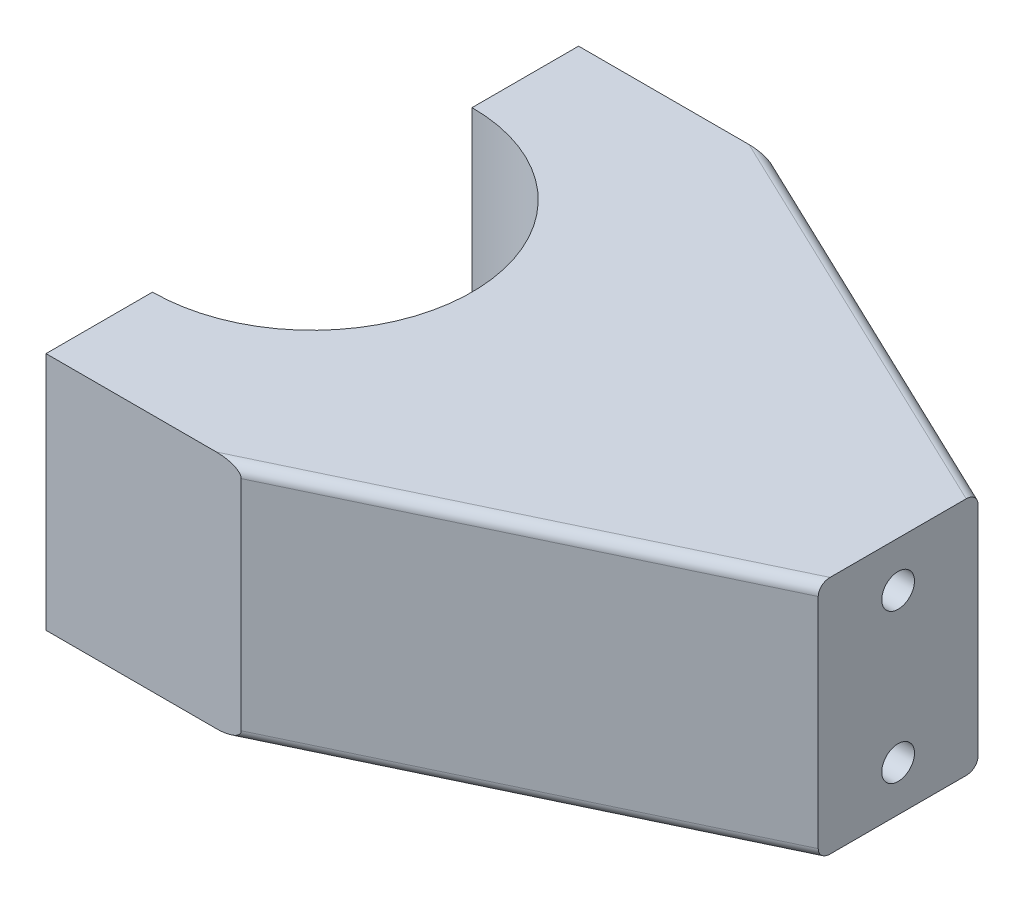
from build123d import *

# Parameters (mm, degrees)
SALIENTE_EXTRUIR1_DEPTH = 45
CROQUIS2_R              = 3.075
CORTAR_EXTRUIR1_DEPTH   = 129.937969582
REDONDEO1_R             = 2


with BuildPart() as part:
    # Croquis1 → Saliente-Extruir1 (new body)
    with BuildSketch(Plane(origin=(0, 0, 0), x_dir=(1, 0, 0), z_dir=(0, 1, 0))):
        with BuildLine():
            Line((0, 30), (0, 50))
            Line((0, 50), (36.66060556, 50))
            Line((36.66060556, 50), (110, 15))
            Line((110, 15), (110, -15))
            Line((110, -15), (36.66060556, -50))
            Line((36.66060556, -50), (0, -50))
            Line((0, -50), (0, -30))
            ThreePointArc((0, -30), (30, 0), (0, 30))
        make_face()
    extrude(amount=SALIENTE_EXTRUIR1_DEPTH)

    # Croquis2 → Cortar-Extruir1 (cut, through all)
    with BuildSketch(Plane(origin=(110, 0, 0), x_dir=(0, 0, -1), z_dir=(1, 0, 0))):
        with Locations((0, 36.5)):
            Circle(CROQUIS2_R)
        with Locations((0, 8.5)):
            Circle(CROQUIS2_R)
    extrude(amount=-CORTAR_EXTRUIR1_DEPTH, mode=Mode.SUBTRACT)

    # Redondeo1
    redondeo1_edges = [part.edges().sort_by_distance(p)[0] for p in [
        (73.33030278, 0, -32.5),
        (73.33030278, 45, -32.5),
        (73.33030278, 0, 32.5),
        (73.33030278, 45, 32.5),
    ]]
    fillet(redondeo1_edges, radius=REDONDEO1_R)


solid = part.part
